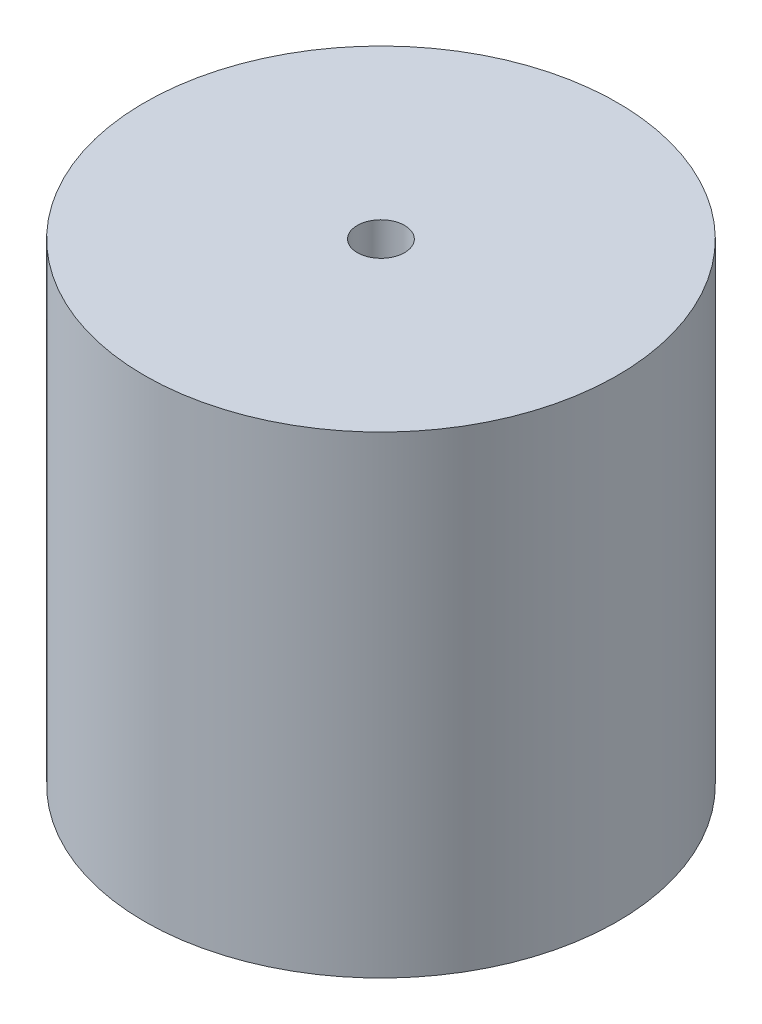
from build123d import *

# Parameters (mm, degrees)
SKETCH2_R           = 15.875
BOSS_EXTRUDE1_DEPTH = 31.75
SKETCH3_R           = 12.065
CUT_EXTRUDE1_DEPTH  = 24.13
CUT_EXTRUDE2_REACH  = 40.886
SKETCH4_R           = 1.5875


with BuildPart() as part:
    # Sketch2 → Boss-Extrude1 (new body)
    with BuildSketch(Plane(origin=(0, 0, 0), x_dir=(1, 0, 0), z_dir=(0, 1, 0))):
        with Locations(Location((0, 0, 0), (0, 0, 270))):
            Circle(SKETCH2_R)
    extrude(amount=BOSS_EXTRUDE1_DEPTH)

    # Sketch3 → Cut-Extrude1 (cut)
    with BuildSketch(Plane.XZ):
        with Locations(Location((0, 0, 0), (0, 0, 270))):
            Circle(SKETCH3_R)
    extrude(amount=-CUT_EXTRUDE1_DEPTH, mode=Mode.SUBTRACT)

    # Sketch4 → Cut-Extrude2 (cut, up to next)
    with BuildSketch(Plane(origin=(0, 31.75, 0), x_dir=(1, 0, 0), z_dir=(0, 1, 0)), mode=Mode.PRIVATE) as cut_extrude2_sk1:
        with Locations(Location((0, 0, 0), (0, 0, 270))):
            Circle(SKETCH4_R)
    cut_extrude2_tool1 = extrude(cut_extrude2_sk1.sketch, amount=-CUT_EXTRUDE2_REACH, mode=Mode.PRIVATE) & part.part
    add(cut_extrude2_tool1.solids().sort_by_distance((0, 31.75, 0))[0], mode=Mode.SUBTRACT)


solid = part.part
